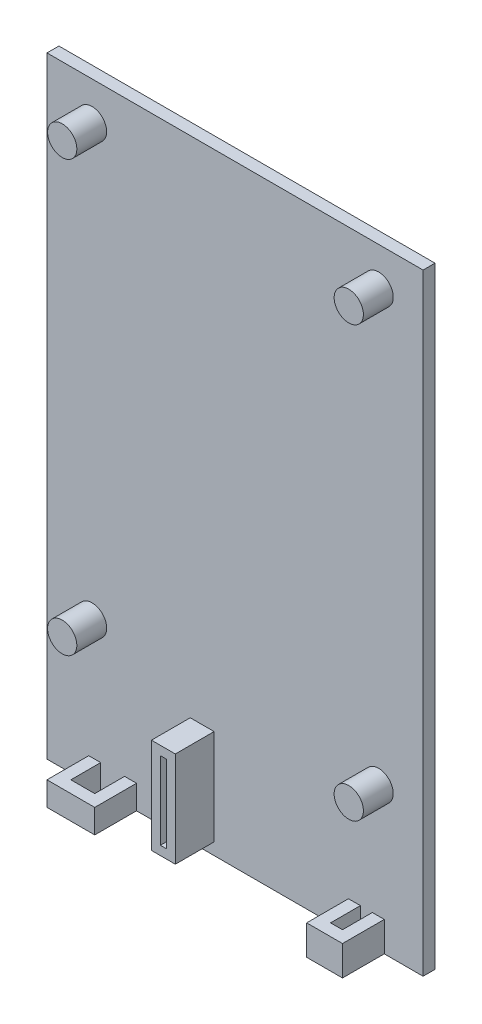
from build123d import *

# Parameters (mm, degrees)
P_IDAT_VYSUNUT_M1_DEPTH   = 2
SKICA3_R                  = 2.45
P_IDAT_VYSUNUT_M3_DEPTH   = 5
P_IDAT_VYSUNUT_M4_DEPTH   = 37.5
SKICA8_W                  = 10
SKICA8_H                  = 10
ODEBRAT_VYSUNUT_M2_DEPTH  = 136.974087605
SKICA10_W                 = 27.5
SKICA10_H                 = 79
ODEBRAT_VYSUNUT_M3_DEPTH  = 3
P_IDAT_VYSUNUT_M5_DEPTH   = 1
SKICA13_W                 = 3
SKICA13_H                 = 36.5
ODEBRAT_VYSUNUT_M6_DEPTH  = 127.590886323
SKICA14_W                 = 3
SKICA14_H                 = 36.5
ODEBRAT_VYSUNUT_M7_DEPTH  = 127.590886323
SKICA15_W                 = 36.5
SKICA15_H                 = 3
ODEBRAT_VYSUNUT_M8_DEPTH  = 136.974087605
SKICA19_W                 = 37
SKICA19_H                 = 13
ODEBRAT_VYSUNUT_M9_DEPTH  = 132.581543159
SKICA20_W                 = 63
SKICA20_H                 = 102.45
SKICA20_W_2               = 57
SKICA20_H_2               = 79
ODEBRAT_VYSUNUT_M10_DEPTH = 1
SKICA22_W                 = 8
SKICA22_H                 = 4
SKICA22_W_2               = 6
SKICA22_H_2               = 5
P_IDAT_VYSUNUT_M6_DEPTH   = 7
SKICA23_W                 = 4
SKICA23_H                 = 5
SKICA23_W_2               = 2
ODEBRAT_VYSUNUT_M12_DEPTH = 5
SKICA25_W                 = 4
SKICA25_H                 = 16
SKICA25_W_2               = 1
SKICA25_H_2               = 13
P_IDAT_VYSUNUT_M8_DEPTH   = 6.5


with BuildPart() as part:
    # Skica1 → Přidat vysunutím1 (new body)
    with BuildSketch(Plane.XY):
        Polygon((13, -102.45), (13, -115.45), (50, -115.45), (50, -102.45), (63, -102.45), (63, 0), (0, 0), (0, -102.45), align=None)
    extrude(amount=P_IDAT_VYSUNUT_M1_DEPTH)

    # Skica3 → Přidat vysunutím3 (add)
    with BuildSketch(Plane.XY.offset(2)):
        with Locations((7.55, -6.45)):
            Circle(SKICA3_R)
        with Locations((7.55, -78.45)):
            Circle(SKICA3_R)
        with Locations((55.55, -78.45)):
            Circle(SKICA3_R)
        with Locations((55.55, -6.45)):
            Circle(SKICA3_R)
    extrude(amount=P_IDAT_VYSUNUT_M3_DEPTH)

    # Skica4 → Přidat vysunutím4 (add)
    with BuildSketch(Plane.XY.offset(2)):
        Polygon((63, 0), (63, -102.45), (60, -102.45), (60, -3), (3, -3), (3, -102.45), (0, -102.45), (0, 0), align=None)
    extrude(amount=P_IDAT_VYSUNUT_M4_DEPTH)

    # Skica8 → Odebrat vysunutím2 (cut, through all)
    with BuildSketch(Plane.ZY.offset(-60)):
        with Locations((7, -49)):
            Rectangle(SKICA8_W, SKICA8_H)
    extrude(amount=-ODEBRAT_VYSUNUT_M2_DEPTH, mode=Mode.SUBTRACT)

    # Skica10 → Odebrat vysunutím3 (cut)
    with BuildSketch(Plane.ZY):
        with Locations((25.75, -42.5)):
            Rectangle(SKICA10_W, SKICA10_H)
    extrude(amount=-ODEBRAT_VYSUNUT_M3_DEPTH, mode=Mode.SUBTRACT)

    # Skica11 → Přidat vysunutím5 (add)
    with BuildSketch(Plane.XY.offset(2)):
        Polygon((3, -82), (60, -82), (60, -102.45), (50, -102.45), (50, -115.45), (13, -115.45), (13, -102.45), (3, -102.45), align=None)
    extrude(amount=P_IDAT_VYSUNUT_M5_DEPTH)

    # Skica13 → Odebrat vysunutím6 (cut, through all)
    with BuildSketch(Plane.XZ.offset(102.45)):
        with Locations((1.5, 21.25)):
            Rectangle(SKICA13_W, SKICA13_H)
    extrude(amount=-ODEBRAT_VYSUNUT_M6_DEPTH, mode=Mode.SUBTRACT)

    # Skica14 → Odebrat vysunutím7 (cut, through all)
    with BuildSketch(Plane.XZ.offset(102.45)):
        with Locations((61.5, 21.25)):
            Rectangle(SKICA14_W, SKICA14_H)
    extrude(amount=-ODEBRAT_VYSUNUT_M7_DEPTH, mode=Mode.SUBTRACT)

    # Skica15 → Odebrat vysunutím8 (cut, through all)
    with BuildSketch(Plane.ZY.offset(-3)):
        with Locations((21.25, -1.5)):
            Rectangle(SKICA15_W, SKICA15_H)
    extrude(amount=-ODEBRAT_VYSUNUT_M8_DEPTH, mode=Mode.SUBTRACT)

    # Skica19 → Odebrat vysunutím9 (cut, through all)
    with BuildSketch(Plane.XY.offset(3)):
        with Locations((31.5, -108.95)):
            Rectangle(SKICA19_W, SKICA19_H)
    extrude(amount=-ODEBRAT_VYSUNUT_M9_DEPTH, mode=Mode.SUBTRACT)

    # Skica20 → Odebrat vysunutím10 (cut)
    with BuildSketch(Plane.XY.offset(3)):
        with Locations((31.5, -51.225)):
            Rectangle(SKICA20_W, SKICA20_H)
        with Locations((31.5, -42.5)):
            Rectangle(SKICA20_W_2, SKICA20_H_2, mode=Mode.SUBTRACT)
    extrude(amount=-ODEBRAT_VYSUNUT_M10_DEPTH, mode=Mode.SUBTRACT)

    # Skica22 → Přidat vysunutím6 (add)
    with BuildSketch(Plane.XY.offset(2)):
        with Locations((11, -100.45)):
            Rectangle(SKICA22_W, SKICA22_H)
        with Locations((53.5, -99.95)):
            Rectangle(SKICA22_W_2, SKICA22_H_2)
    extrude(amount=P_IDAT_VYSUNUT_M6_DEPTH)

    # Skica23 → Odebrat vysunutím12 (cut)
    with BuildSketch(Plane.XZ.offset(102.45)):
        with Locations((11, 4.5)):
            Rectangle(SKICA23_W, SKICA23_H)
        with Locations((53.5, 4.5)):
            Rectangle(SKICA23_W_2, SKICA23_H)
    extrude(amount=-ODEBRAT_VYSUNUT_M12_DEPTH, mode=Mode.SUBTRACT)

    # Skica25 → Přidat vysunutím8 (add)
    with BuildSketch(Plane.XY.offset(2)):
        with Locations((26, -92.45)):
            Rectangle(SKICA25_W, SKICA25_H)
        with Locations((26, -92.45)):
            Rectangle(SKICA25_W_2, SKICA25_H_2, mode=Mode.SUBTRACT)
    extrude(amount=P_IDAT_VYSUNUT_M8_DEPTH)


solid = part.part
